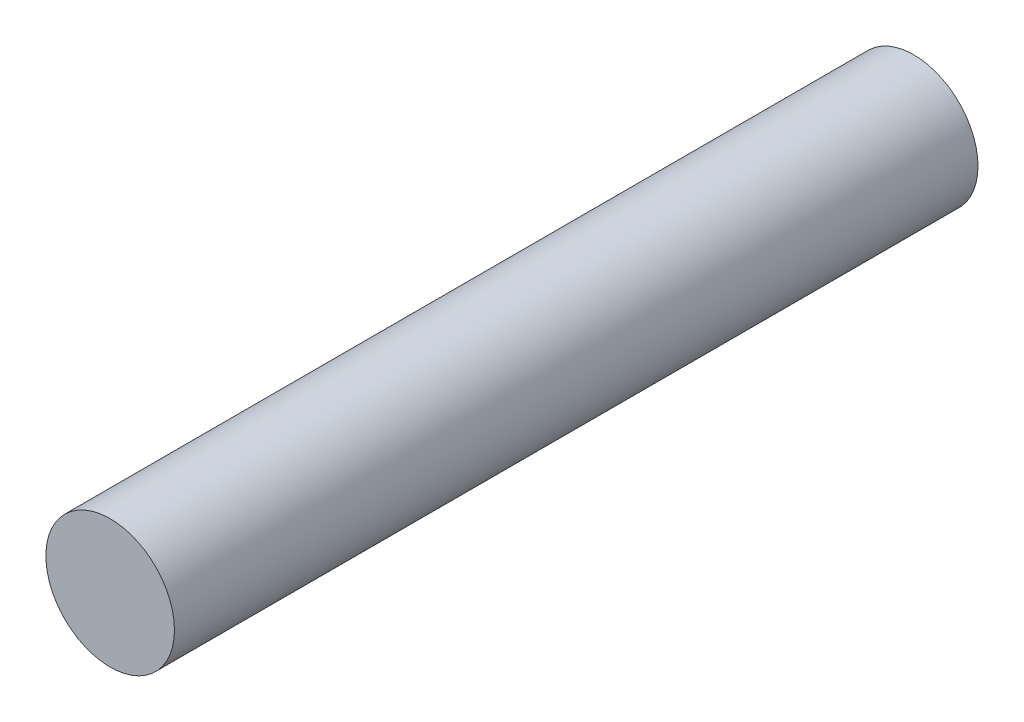
from build123d import *

# Parameters (mm, degrees)
SKETCH_1_R      = 0.4
EXTRUDE_1_DEPTH = 5


with BuildPart() as part:
    # 草图1 → 凸台-拉伸1 (new body)
    with BuildSketch(Plane.XY):
        Circle(SKETCH_1_R)
    extrude(amount=EXTRUDE_1_DEPTH)


solid = part.part
